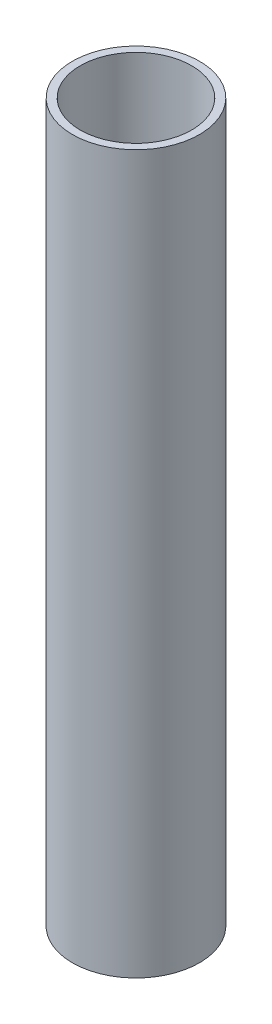
from build123d import *

# Parameters (mm, degrees)
SKETCH1_R           = 3.1
SKETCH1_R_2         = 2.72
BOSS_EXTRUDE1_DEPTH = 35


with BuildPart() as part:
    # Sketch1 → Boss-Extrude1 (new body)
    with BuildSketch(Plane(origin=(0, 0, 0), x_dir=(1, 0, 0), z_dir=(0, 1, 0))):
        with Locations(Location((0, 0, 0), (0, 0, 270))):
            Circle(SKETCH1_R)
        with Locations(Location((0, 0, 0), (0, 0, 270))):
            Circle(SKETCH1_R_2, mode=Mode.SUBTRACT)
    extrude(amount=BOSS_EXTRUDE1_DEPTH)


solid = part.part
